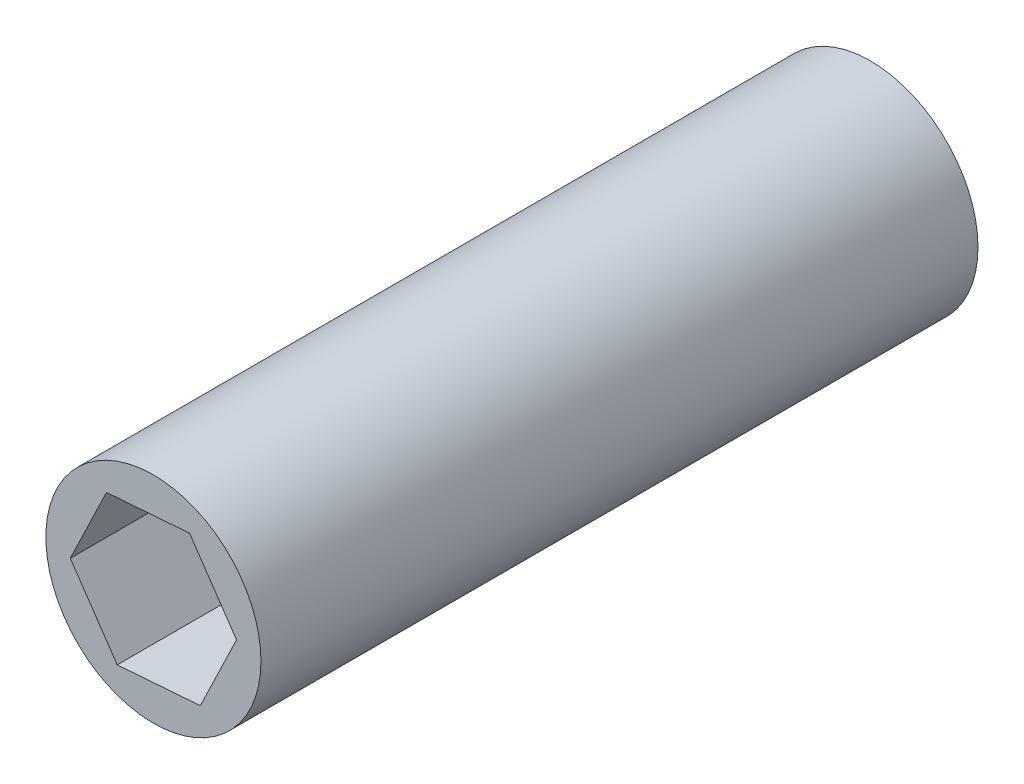
from build123d import *

# Parameters (mm, degrees)
SKETCH1_R           = 1.5
BOSS_EXTRUDE1_DEPTH = 10
CUT_EXTRUDE1_DEPTH  = 3


with BuildPart() as part:
    # Sketch1 → Boss-Extrude1 (new body)
    with BuildSketch(Plane.XY):
        Circle(SKETCH1_R)
    extrude(amount=BOSS_EXTRUDE1_DEPTH)

    # Sketch2 → Cut-Extrude1 (cut)
    with BuildSketch(Plane.XY.offset(10)):
        Polygon((0.65442145, -0.960492555), (1.159021678, 0.086499322), (0.504600228, 1.046991878), (-0.65442145, 0.960492555), (-1.159021678, -0.086499322), (-0.504600228, -1.046991878), align=None)
    extrude(amount=-CUT_EXTRUDE1_DEPTH, mode=Mode.SUBTRACT)


solid = part.part
